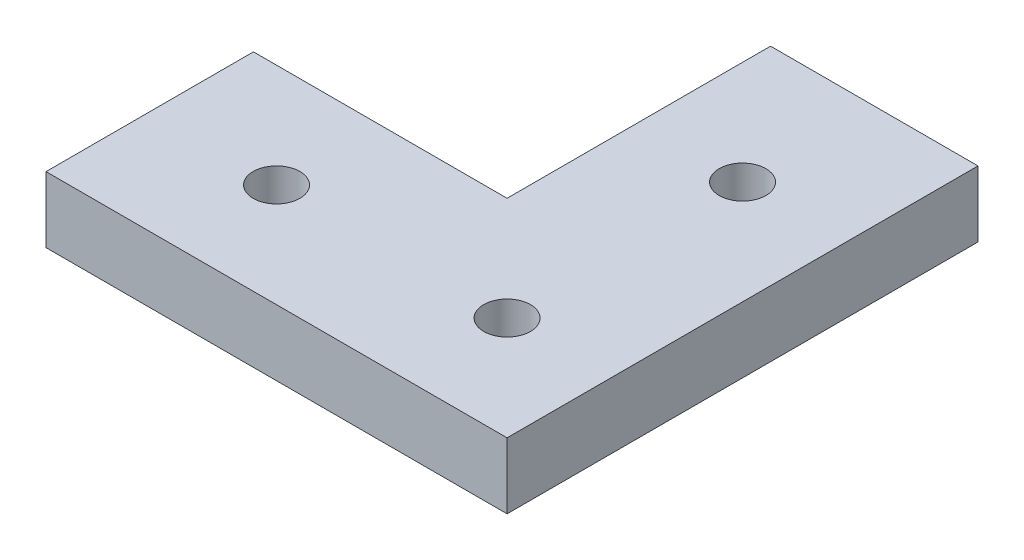
from build123d import *

# Parameters (mm, degrees)
SKETCH1_W           = 20
SKETCH1_H           = 25.4
SKETCH1_W_2         = 44.45
SKETCH1_H_2         = 20
BOSS_EXTRUDE1_DEPTH = 6.35
SKETCH2_R           = 2.25
CUT_EXTRUDE1_DEPTH  = 6.35


with BuildPart() as part:
    # Sketch1 → Boss-Extrude1 (new body)
    with BuildSketch(Plane(origin=(0, 0, 0), x_dir=(1, 0, 0), z_dir=(0, 1, 0))):
        with Locations((34.45, 32.7)):
            Rectangle(SKETCH1_W, SKETCH1_H)
        with Locations((22.225, 10)):
            Rectangle(SKETCH1_W_2, SKETCH1_H_2)
    extrude(amount=BOSS_EXTRUDE1_DEPTH)

    # Sketch2 → Cut-Extrude1 (cut)
    with BuildSketch(Plane(origin=(0, 6.35, 0), x_dir=(1, 0, 0), z_dir=(0, 1, 0))):
        with Locations(Location((12.225, 10, 0), (0, 0, 270))):
            Circle(SKETCH2_R)
        with Locations(Location((34.45, 10, 0), (0, 0, 270))):
            Circle(SKETCH2_R)
        with Locations(Location((34.45, 32.7, 0), (0, 0, 270))):
            Circle(SKETCH2_R)
    extrude(amount=-CUT_EXTRUDE1_DEPTH, mode=Mode.SUBTRACT)


solid = part.part
